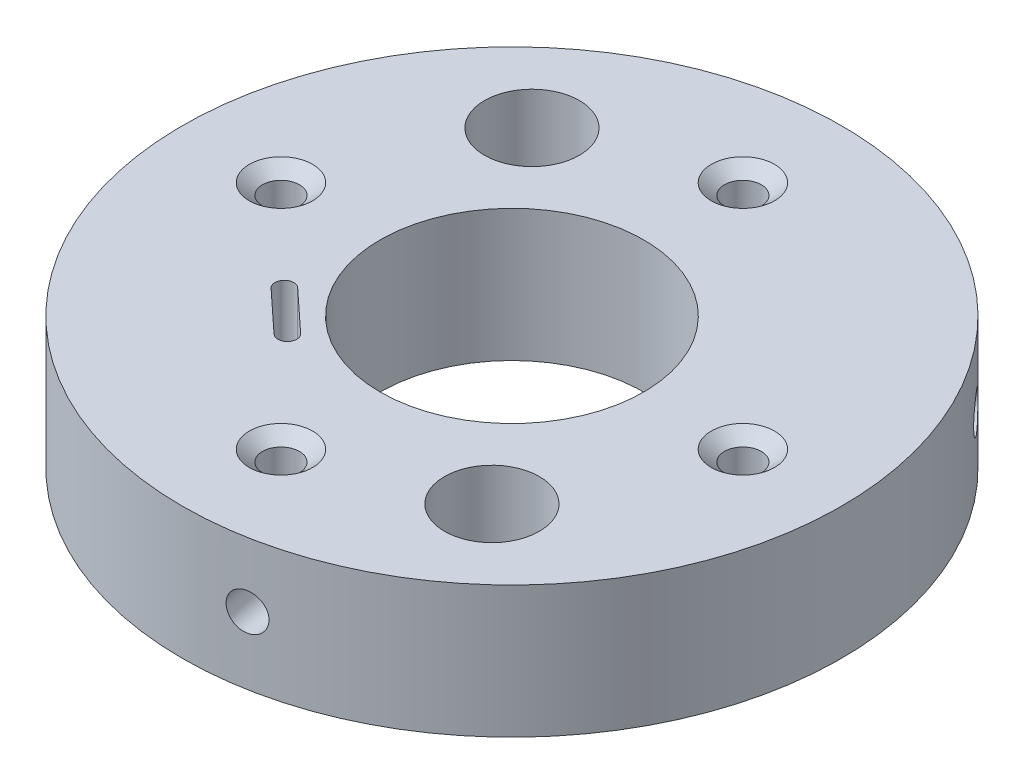
from build123d import *

# Parameters (mm, degrees)
SKETCH1_R                           = 15.875
BOSS_EXTRUDE1_DEPTH                 = 6.35
SKETCH2_R                           = 6.35
CUT_EXTRUDE1_DEPTH                  = 24.3313898
TAP_DRILL_FOR_2_56_TAP2_D           = 1.778
TAP_DRILL_FOR_2_56_TAP2_CSINK_D     = 3.048
TAP_DRILL_FOR_2_56_TAP2_CSINK_ANGLE = 100
CIRPATTERN1_COUNT                   = 2
CIRPATTERN2_COUNT                   = 2
SKETCH11_R                          = 2.286
CUT_EXTRUDE2_DEPTH                  = 24.3313898
CIRPATTERN3_COUNT                   = 2
CIRPATTERN4_COUNT                   = 3
CUT_EXTRUDE3_DEPTH                  = 24.331389963


with BuildPart() as part:
    # Sketch1 → Boss-Extrude1 (new body)
    with BuildSketch(Plane(origin=(0, 0, 0), x_dir=(1, 0, 0), z_dir=(0, 1, 0))):
        with Locations(Location((0, 0, 0), (0, 0, 270))):
            Circle(SKETCH1_R)
    extrude(amount=BOSS_EXTRUDE1_DEPTH)

    # Sketch2 → Cut-Extrude1 (cut, through all)
    with BuildSketch(Plane(origin=(0, 6.35, 0), x_dir=(1, 0, 0), z_dir=(0, 1, 0))):
        with Locations(Location((0, 0, 0), (0, 0, 270))):
            Circle(SKETCH2_R)
    extrude(amount=-CUT_EXTRUDE1_DEPTH, mode=Mode.SUBTRACT)

    # Tap Drill for #2-56 Tap2 (through all)
    with Locations(Plane(origin=(0, 6.35, 0), x_dir=(1, 0, 0), z_dir=(0, 1, 0))):
        with Locations((0, 11.1252)):
            tap_drill_for_2_56_tap2 = CounterSinkHole(TAP_DRILL_FOR_2_56_TAP2_D / 2, TAP_DRILL_FOR_2_56_TAP2_CSINK_D / 2, counter_sink_angle=TAP_DRILL_FOR_2_56_TAP2_CSINK_ANGLE)

    # CirPattern1: Tap Drill for #2-56 Tap2 ×2 about axis
    cirpattern1_axis = Axis((0, 0, 0), (0, 1, 0))
    for i in range(1, CIRPATTERN1_COUNT):
        add(tap_drill_for_2_56_tap2.rotate(cirpattern1_axis, i * 360 / CIRPATTERN1_COUNT), mode=Mode.SUBTRACT)

    # Sketch10 → Tap Drill for #2-56 Tap1 (revolve, cut)
    with BuildSketch(Plane(origin=(11.1252, 6.35, 0), x_dir=(0, 0, 1), z_dir=(1, 0, 0))):
        Polygon((0, 0), (0, 4.34416509), (0.889, 3.81), (0.889, 0.532828266), (1.524, 0), align=None)
    tap_drill_for_2_56_tap1 = revolve(axis=Axis((11.1252, 12.7, 0), (0, -1, 0)), mode=Mode.SUBTRACT)

    # CirPattern2: Tap Drill for #2-56 Tap1 ×2 about axis
    cirpattern2_axis = Axis((0, 0, 0), (0, 1, 0))
    for i in range(1, CIRPATTERN2_COUNT):
        add(tap_drill_for_2_56_tap1.rotate(cirpattern2_axis, i * 360 / CIRPATTERN2_COUNT), mode=Mode.SUBTRACT)

    # Sketch11 → Cut-Extrude2 (cut, through all)
    with BuildSketch(Plane(origin=(0, 6.35, 0), x_dir=(1, 0, 0), z_dir=(0, 1, 0))):
        with Locations(Location((-7.360856908, 8.324988999, 0), (0, 0, 270))):
            Circle(SKETCH11_R)
    cut_extrude2 = extrude(amount=-CUT_EXTRUDE2_DEPTH, mode=Mode.SUBTRACT)

    # CirPattern3: Cut-Extrude2 ×2 about axis
    cirpattern3_axis = Axis((0, 0, 0), (0, 1, 0))
    for i in range(1, CIRPATTERN3_COUNT):
        add(cut_extrude2.rotate(cirpattern3_axis, i * 360 / CIRPATTERN3_COUNT), mode=Mode.SUBTRACT)

    # Sketch16 → Tap Drill for #2-56 Tap3 (revolve, cut)
    with BuildSketch(Plane(origin=(12.093135875, 3.244987275, -10.284536436), x_dir=(-0.6478448148472237, 0, -0.7617723386127685), z_dir=(0, 1, 0))):
        Polygon((0, 0), (0, 7.095959572), (0.889, 6.35), (0.889, 0), align=None)
    tap_drill_for_2_56_tap3 = revolve(axis=Axis((16.930390226, 3.244987275, -14.39835101), (-0.7617723386127686, 0, 0.6478448148472237)), mode=Mode.SUBTRACT)

    # CirPattern4: Tap Drill for #2-56 Tap3 ×3 about axis
    cirpattern4_axis = Axis((0, 6.35, 0), (0, -1, 0))
    for i in range(1, CIRPATTERN4_COUNT):
        add(tap_drill_for_2_56_tap3.rotate(cirpattern4_axis, i * 360 / CIRPATTERN4_COUNT), mode=Mode.SUBTRACT)

    # Sketch17 → Cut-Extrude3 (cut, through all)
    with BuildSketch(Plane(origin=(0, 6.35, 0), x_dir=(1, 0, 0), z_dir=(0, 1, 0))):
        with BuildLine():
            Line((-4.96914615, -6.489934512), (-6.955810814, -4.646503161))
            ThreePointArc((-6.955810814, -4.646503161), (-6.979764598, -4.005972756), (-6.339234193, -3.982018972))
            Line((-6.339234193, -3.982018972), (-4.352569529, -5.825450323))
            ThreePointArc((-4.352569529, -5.825450323), (-4.328615745, -6.465980728), (-4.96914615, -6.489934512))
        make_face()
    extrude(amount=-CUT_EXTRUDE3_DEPTH, mode=Mode.SUBTRACT)


solid = part.part
